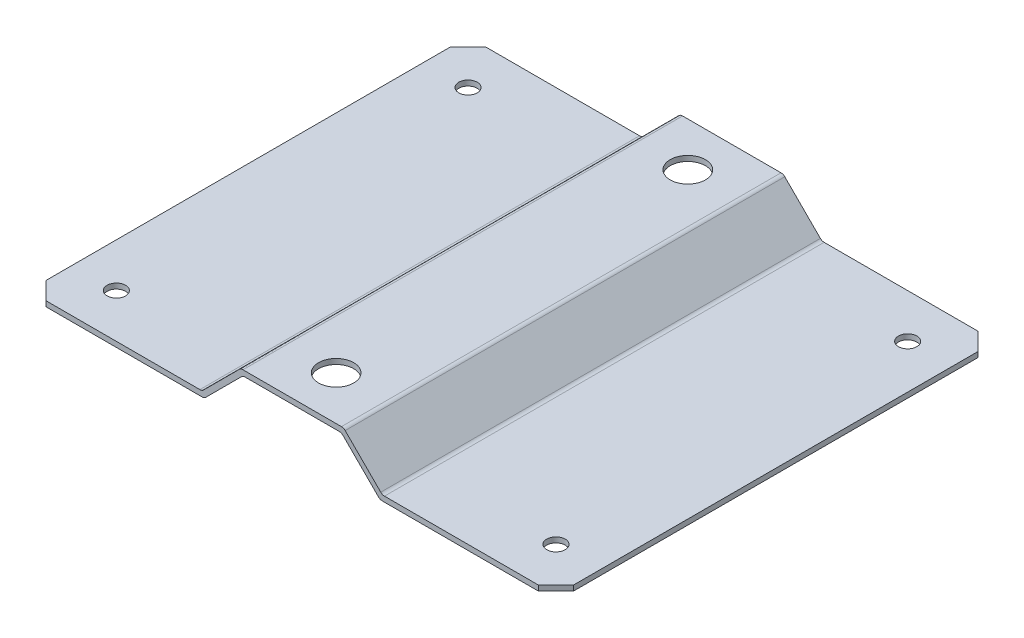
from build123d import *

# Parameters (mm, degrees)
EXTRUDE_1_DEPTH           = 250
HOLE_WIZARD_3_0_3_1_D     = 20
HOLE_WIZARD_3_0_3_1_DEPTH = 42.5
HOLE_WIZARD_3_0_3_1_TIP   = 6.00860619
FILLET_1_R                = 3
HOLE_WIZARD_10_5_10_5_1_D = 10.5
CHAMFER_1_SIZE            = 10


with BuildPart() as part:
    # 草图1 → 凸台-拉伸1 (new body)
    with BuildSketch(Plane.XY):
        Polygon((0, 0), (100, 0), (122, 22), (178, 22), (200, 0), (300, 0), (300, 3), (201.242640687, 3), (179.242640687, 25), (120.757359313, 25), (98.757359313, 3), (0, 3), align=None)
    extrude(amount=EXTRUDE_1_DEPTH)

    # Ø3.0 (3) 直径孔1
    with Locations(Plane(origin=(0, 22, 0), x_dir=(-1, 0, 0), z_dir=(0, -1, 0))):
        with Locations((-150, -225), (-150, -25)):
            Hole(HOLE_WIZARD_3_0_3_1_D / 2, depth=HOLE_WIZARD_3_0_3_1_DEPTH)
            with Locations((0, 0, -(HOLE_WIZARD_3_0_3_1_DEPTH + HOLE_WIZARD_3_0_3_1_TIP / 2))):  # 118° drill point
                Cone(0, HOLE_WIZARD_3_0_3_1_D / 2, HOLE_WIZARD_3_0_3_1_TIP, mode=Mode.SUBTRACT)

    # 圆角1
    fillet_1_edges = [part.edges().sort_by_distance(p)[0] for p in [
        (98.757359313, 3, 125),
        (120.757359313, 25, 125),
        (179.242640687, 25, 125),
        (201.242640687, 3, 125),
        (200, 0, 125),
        (178, 22, 125),
        (122, 22, 125),
        (100, 0, 125),
    ]]
    fillet(fillet_1_edges, radius=FILLET_1_R)

    # Ø10.5 (10.5) 直径孔1 (through all)
    with Locations(Plane(origin=(0, 0, 0), x_dir=(-1, 0, 0), z_dir=(0, -1, 0))):
        with Locations((-25, -225), (-25, -25), (-275, -225), (-275, -25)):
            Hole(HOLE_WIZARD_10_5_10_5_1_D / 2)

    # 倒角1
    chamfer_1_edges = [part.edges().sort_by_distance(p)[0] for p in [
        (300, 1.5, 0),
        (0, 1.5, 0),
        (300, 1.5, 250),
        (0, 1.5, 250),
    ]]
    chamfer(chamfer_1_edges, length=CHAMFER_1_SIZE)


solid = part.part
